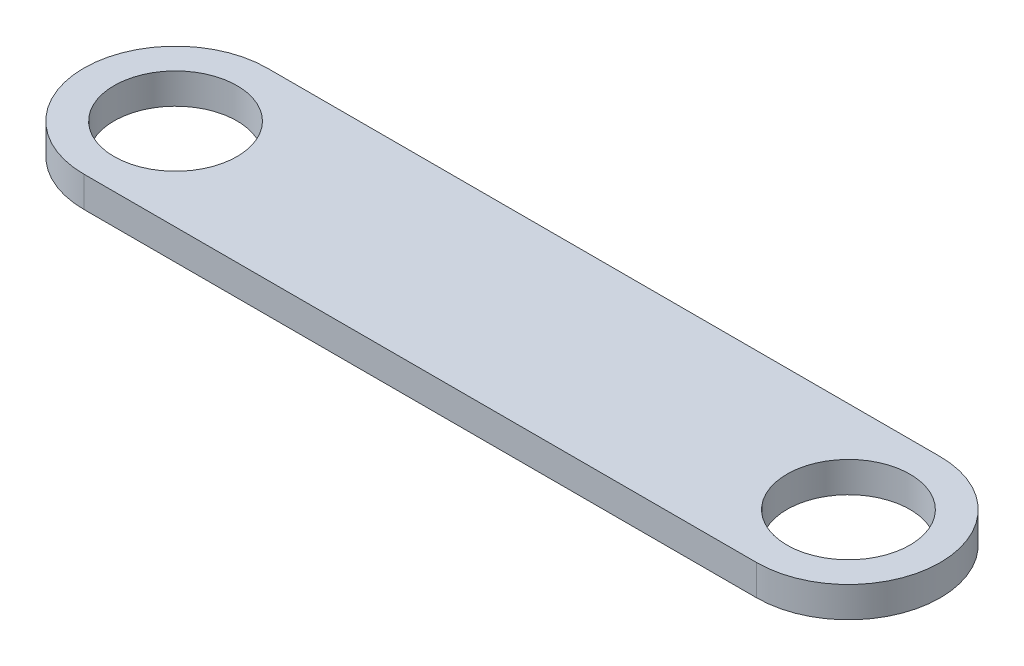
from build123d import *

# Parameters (mm, degrees)
SKETCH1_R           = 5.025
BOSS_EXTRUDE1_DEPTH = 2.5


with BuildPart() as part:
    # Sketch1 → Boss-Extrude1 (new body)
    with BuildSketch(Plane(origin=(0, 0, 0), x_dir=(1, 0, 0), z_dir=(0, 1, 0))):
        with BuildLine():
            Line((-27.5, 7.5), (27.5, 7.5))
            ThreePointArc((27.5, 7.5), (35, 0), (27.5, -7.5))
            Line((27.5, -7.5), (-27.5, -7.5))
            ThreePointArc((-27.5, -7.5), (-35, 0), (-27.5, 7.5))
        make_face()
        with Locations(Location((-27.5, 0, 0), (0, 0, 270))):
            Circle(SKETCH1_R, mode=Mode.SUBTRACT)
        with Locations(Location((27.5, 0, 0), (0, 0, 270))):
            Circle(SKETCH1_R, mode=Mode.SUBTRACT)
    extrude(amount=BOSS_EXTRUDE1_DEPTH)


solid = part.part
